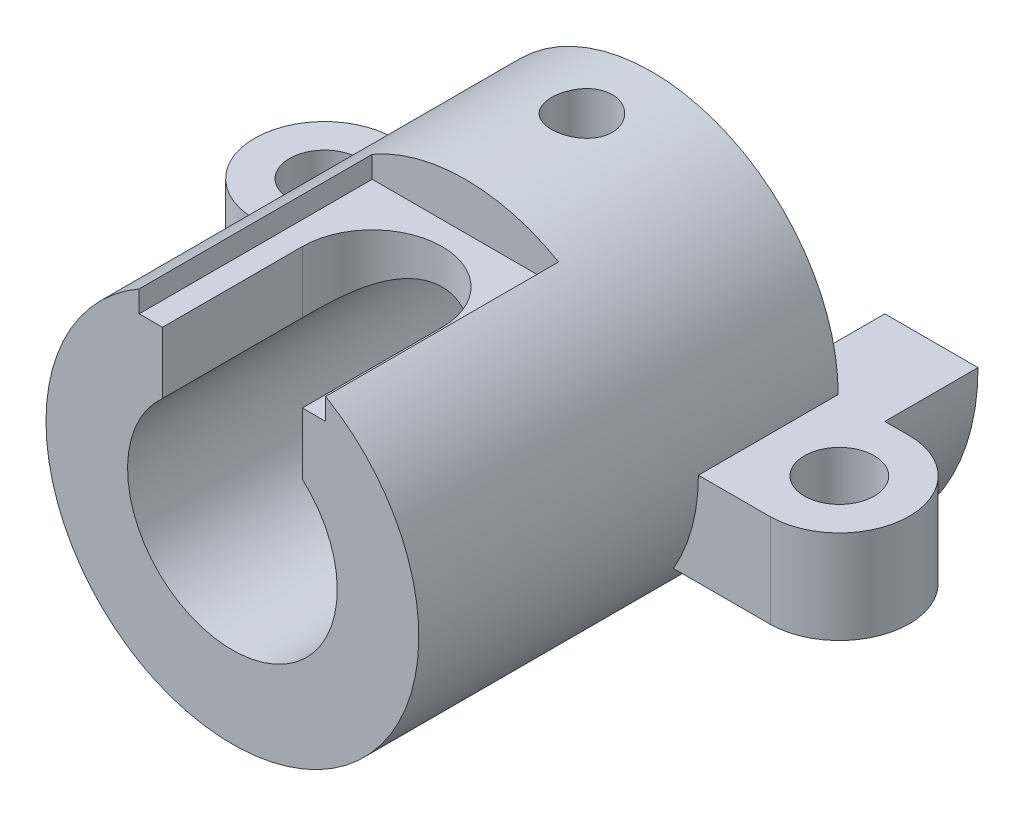
from build123d import *

# Parameters (mm, degrees)
SKETCH1_R                 = 40
SKETCH1_R_2               = 22.5
BOSS_EXTRUDE1_DEPTH       = 90
BOSS_EXTRUDE2_DEPTH       = 20
SKETCH3_R                 = 7.5
BOSS_EXTRUDE9_DEPTH       = 20
CUT_EXTRUDE1_REACH        = 147.378
CUT_EXTRUDE1_END_RADIUS   = 22.5
SKETCH5_R                 = 6.5
SKETCH5_3_W               = 40
SKETCH5_3_H               = 100
CUT_EXTRUDE2_DEPTH        = 10
F_2_0MM_DOWEL_HOLE1_D     = 11
F_2_0MM_DOWEL_HOLE1_DEPTH = 16
F_2_0MM_DOWEL_HOLE1_TIP   = 3.175426481


with BuildPart() as part:
    # Sketch1 → Boss-Extrude1 (new body)
    with BuildSketch(Plane.XY):
        Circle(SKETCH1_R)
        Circle(SKETCH1_R_2, mode=Mode.SUBTRACT)
    extrude(amount=BOSS_EXTRUDE1_DEPTH)

    # Sketch1<3> → Boss-Extrude2 (add)
    with BuildSketch(Plane.XY):
        with BuildLine():
            ThreePointArc((-50, 0), (0, -50), (50, 0))
            Line((50, 0), (30, 0))
            ThreePointArc((30, 0), (0, -30), (-30, 0))
            Line((-30, 0), (-50, 0))
        make_face()
    extrude(amount=-BOSS_EXTRUDE2_DEPTH)

    # Sketch3 → Boss-Extrude9 (add)
    # profile 1 of 2: a face of its own
    with BuildSketch(Plane(origin=(0, 0, 0), x_dir=(1, 0, 0), z_dir=(0, 1, 0))):
        with BuildLine():
            Line((34.445197512, 0), (55, 0))
            ThreePointArc((55, 0), (70.244929467, -14.755070533), (55.489858934, -30))
            Line((55.489858934, -30), (34.445197512, -30))
            Line((34.445197512, -30), (34.445197512, 0))
        make_face()
        with Locations((55.244929467, -15)):
            Circle(SKETCH3_R, mode=Mode.SUBTRACT)
    # profile 2 of 2: a face of its own
    with BuildSketch(Plane(origin=(0, 0, 0), x_dir=(1, 0, 0), z_dir=(0, 1, 0))):
        with BuildLine():
            Line((-34.445197512, 0), (-34.445197512, -30))
            Line((-34.445197512, -30), (-55.489858934, -30))
            ThreePointArc((-55.489858934, -30), (-70.244929467, -14.755070533), (-55, 0))
            Line((-55, 0), (-34.445197512, 0))
        make_face()
        with Locations((-55.244929467, -15)):
            Circle(SKETCH3_R, mode=Mode.SUBTRACT)
    extrude(amount=-BOSS_EXTRUDE9_DEPTH)

    # Cut-Extrude1: up to this cylinder (the profile starts outside it)
    cut_extrude1_end = Plane(origin=(0, 0, 41.9876885), z_dir=(0, 0, -1)) * Cylinder(CUT_EXTRUDE1_END_RADIUS, 394.731377, mode=Mode.PRIVATE)
    # Sketch5 → Cut-Extrude1 (cut, up to the surface)
    with BuildSketch(Plane(origin=(0, 40, 0), x_dir=(1, 0, 0), z_dir=(0, 1, 0)), mode=Mode.PRIVATE) as cut_extrude1_sk1:
        with BuildLine():
            ThreePointArc((15, -60), (0, -45), (-15, -60))
            Line((-15, -60), (-15, -90))
            Line((-15, -90), (15, -90))
            Line((15, -90), (15, -60))
        make_face()
    cut_extrude1_tool1 = extrude(cut_extrude1_sk1.sketch, amount=-CUT_EXTRUDE1_REACH, mode=Mode.PRIVATE) - cut_extrude1_end
    add(cut_extrude1_tool1.solids().sort_by_distance((0, 40, 68.975377))[0], mode=Mode.SUBTRACT)
    # Sketch5 → Cut-Extrude1 (cut, up to the surface)
    with BuildSketch(Plane(origin=(0, 40, 0), x_dir=(1, 0, 0), z_dir=(0, 1, 0)), mode=Mode.PRIVATE) as cut_extrude1_sk2:
        with Locations((0, -15)):
            Circle(SKETCH5_R)
    cut_extrude1_tool2 = extrude(cut_extrude1_sk2.sketch, amount=-CUT_EXTRUDE1_REACH, mode=Mode.PRIVATE) - cut_extrude1_end
    add(cut_extrude1_tool2.solids().sort_by_distance((0, 40, 15))[0], mode=Mode.SUBTRACT)

    # Sketch5<3> → Cut-Extrude2 (cut)
    with BuildSketch(Plane(origin=(0, 40, 0), x_dir=(1, 0, 0), z_dir=(0, 1, 0))):
        with Locations((0, -90)):
            Rectangle(SKETCH5_3_W, SKETCH5_3_H)
        with BuildLine():
            Line((-15, -90), (-15, -60))
            ThreePointArc((-15, -60), (0, -45), (15, -60))
            Line((15, -60), (15, -90))
            Line((15, -90), (-15, -90))
        make_face(mode=Mode.SUBTRACT)
    extrude(amount=-CUT_EXTRUDE2_DEPTH, mode=Mode.SUBTRACT)

    # Ø2.0mm Dowel Hole1
    with Locations(Plane(origin=(0, 0, -20), x_dir=(-1, 0, 0), z_dir=(0, 0, -1))):
        with Locations((0, -40)):
            Hole(F_2_0MM_DOWEL_HOLE1_D / 2, depth=F_2_0MM_DOWEL_HOLE1_DEPTH)
            with Locations((0, 0, -(F_2_0MM_DOWEL_HOLE1_DEPTH + F_2_0MM_DOWEL_HOLE1_TIP / 2))):  # 120° drill point
                Cone(0, F_2_0MM_DOWEL_HOLE1_D / 2, F_2_0MM_DOWEL_HOLE1_TIP, mode=Mode.SUBTRACT)


solid = part.part
